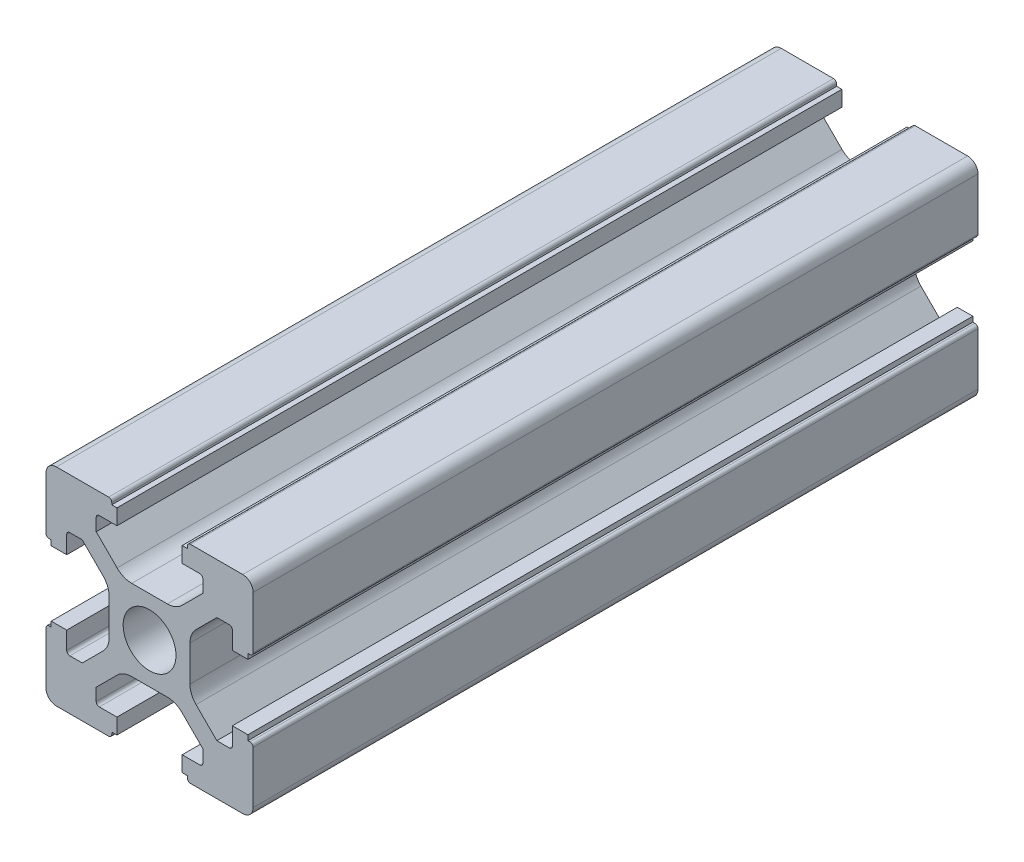
from build123d import *

# Parameters (mm, degrees)
SKETCH_1_RX     = 2.55
SKETCH_1_RY     = 2.55
EXTRUDE_1_DEPTH = 70


with BuildPart() as part:
    # 草图1 → 凸台-拉伸1 (new body)
    with BuildSketch(Plane.XY):
        with BuildLine():
            Line((-10, -9), (-10, -3.95))
            add(Edge.make_bspline(
                [(-9.7, -3.65), (-10, -3.65), (-10, -3.95)],
                knots=[4.71238898, 4.71238898, 4.71238898, 6.283185307, 6.283185307, 6.283185307], degree=2, weights=[1, 0.707106781, 1]))
            Line((-9.7, -3.65), (-9.5, -3.65))
            Line((-9.5, -3.65), (-9.5, -3.15))
            Line((-9.5, -3.15), (-8, -3.15))
            Line((-8, -3.15), (-8, -4.85))
            add(Edge.make_bspline(
                [(-8, -4.85), (-8, -5.15), (-7.7, -5.15)],
                knots=[3.141592654, 3.141592654, 3.141592654, 4.71238898, 4.71238898, 4.71238898], degree=2, weights=[1, 0.707106781, 1]))
            Line((-7.7, -5.15), (-6.5, -5.15))
            Line((-6.5, -5.15), (-4.485786438, -3.135786438))
            add(Edge.make_bspline(
                [(-4.485786438, -3.135786438), (-3.9, -2.55), (-3.9, -1.721572875)],
                knots=[0.785398163, 0.785398163, 0.785398163, 1.570796327, 1.570796327, 1.570796327], degree=2, weights=[1, 0.923879533, 1]))
            Line((-3.9, -1.721572875), (-3.9, 1.721572875))
            add(Edge.make_bspline(
                [(-3.9, 1.721572875), (-3.9, 2.55), (-4.485786438, 3.135786438)],
                knots=[0, 0, 0, 0.785398163, 0.785398163, 0.785398163], degree=2, weights=[1, 0.923879533, 1]))
            Line((-4.485786438, 3.135786438), (-6.5, 5.15))
            Line((-6.5, 5.15), (-7.7, 5.15))
            add(Edge.make_bspline(
                [(-7.7, 5.15), (-8, 5.15), (-8, 4.85)],
                knots=[1.570796327, 1.570796327, 1.570796327, 3.141592654, 3.141592654, 3.141592654], degree=2, weights=[1, 0.707106781, 1]))
            Line((-8, 4.85), (-8, 3.15))
            Line((-8, 3.15), (-9.5, 3.15))
            Line((-9.5, 3.15), (-9.5, 3.65))
            Line((-9.5, 3.65), (-9.7, 3.65))
            add(Edge.make_bspline(
                [(-10, 3.95), (-10, 3.65), (-9.7, 3.65)],
                knots=[3.141592654, 3.141592654, 3.141592654, 4.71238898, 4.71238898, 4.71238898], degree=2, weights=[1, 0.707106781, 1]))
            Line((-10, 3.95), (-10, 9))
            add(Edge.make_bspline(
                [(-9, 10), (-10, 10), (-10, 9)],
                knots=[4.71238898, 4.71238898, 4.71238898, 6.283185307, 6.283185307, 6.283185307], degree=2, weights=[1, 0.707106781, 1]))
            Line((-9, 10), (-3.95, 10))
            add(Edge.make_bspline(
                [(-3.65, 9.7), (-3.65, 10), (-3.95, 10)],
                knots=[0, 0, 0, 1.570796327, 1.570796327, 1.570796327], degree=2, weights=[1, 0.707106781, 1]))
            Line((-3.65, 9.7), (-3.65, 9.5))
            Line((-3.65, 9.5), (-3.15, 9.5))
            Line((-3.15, 9.5), (-3.15, 8))
            Line((-3.15, 8), (-4.85, 8))
            add(Edge.make_bspline(
                [(-4.85, 8), (-5.15, 8), (-5.15, 7.7)],
                knots=[1.570796327, 1.570796327, 1.570796327, 3.141592654, 3.141592654, 3.141592654], degree=2, weights=[1, 0.707106781, 1]))
            Line((-5.15, 7.7), (-5.15, 6.5))
            Line((-5.15, 6.5), (-3.135786438, 4.485786438))
            add(Edge.make_bspline(
                [(-3.135786438, 4.485786438), (-2.55, 3.9), (-1.721572875, 3.9)],
                knots=[3.926990817, 3.926990817, 3.926990817, 4.71238898, 4.71238898, 4.71238898], degree=2, weights=[1, 0.923879533, 1]))
            Line((-1.721572875, 3.9), (1.721572875, 3.9))
            add(Edge.make_bspline(
                [(1.721572875, 3.9), (2.55, 3.9), (3.135786438, 4.485786438)],
                knots=[1.570796327, 1.570796327, 1.570796327, 2.35619449, 2.35619449, 2.35619449], degree=2, weights=[1, 0.923879533, 1]))
            Line((3.135786438, 4.485786438), (5.15, 6.5))
            Line((5.15, 6.5), (5.15, 7.7))
            add(Edge.make_bspline(
                [(5.15, 7.7), (5.15, 8), (4.85, 8)],
                knots=[4.71238898, 4.71238898, 4.71238898, 6.283185307, 6.283185307, 6.283185307], degree=2, weights=[1, 0.707106781, 1]))
            Line((4.85, 8), (3.15, 8))
            Line((3.15, 8), (3.15, 9.5))
            Line((3.15, 9.5), (3.65, 9.5))
            Line((3.65, 9.5), (3.65, 9.7))
            add(Edge.make_bspline(
                [(3.95, 10), (3.65, 10), (3.65, 9.7)],
                knots=[0, 0, 0, 1.570796327, 1.570796327, 1.570796327], degree=2, weights=[1, 0.707106781, 1]))
            Line((3.95, 10), (9, 10))
            add(Edge.make_bspline(
                [(10, 9), (10, 10), (9, 10)],
                knots=[0, 0, 0, 1.570796327, 1.570796327, 1.570796327], degree=2, weights=[1, 0.707106781, 1]))
            Line((10, 9), (10, 3.95))
            add(Edge.make_bspline(
                [(9.7, 3.65), (10, 3.65), (10, 3.95)],
                knots=[4.71238898, 4.71238898, 4.71238898, 6.283185307, 6.283185307, 6.283185307], degree=2, weights=[1, 0.707106781, 1]))
            Line((9.7, 3.65), (9.5, 3.65))
            Line((9.5, 3.65), (9.5, 3.15))
            Line((9.5, 3.15), (8, 3.15))
            Line((8, 3.15), (8, 4.85))
            add(Edge.make_bspline(
                [(8, 4.85), (8, 5.15), (7.7, 5.15)],
                knots=[3.141592654, 3.141592654, 3.141592654, 4.71238898, 4.71238898, 4.71238898], degree=2, weights=[1, 0.707106781, 1]))
            Line((7.7, 5.15), (6.5, 5.15))
            Line((6.5, 5.15), (4.485786438, 3.135786438))
            add(Edge.make_bspline(
                [(4.485786438, 3.135786438), (3.9, 2.55), (3.9, 1.721572875)],
                knots=[2.35619449, 2.35619449, 2.35619449, 3.141592654, 3.141592654, 3.141592654], degree=2, weights=[1, 0.923879533, 1]))
            Line((3.9, 1.721572875), (3.9, -1.721572875))
            add(Edge.make_bspline(
                [(3.9, -1.721572875), (3.9, -2.55), (4.485786438, -3.135786438)],
                knots=[3.141592654, 3.141592654, 3.141592654, 3.926990817, 3.926990817, 3.926990817], degree=2, weights=[1, 0.923879533, 1]))
            Line((4.485786438, -3.135786438), (6.5, -5.15))
            Line((6.5, -5.15), (7.7, -5.15))
            add(Edge.make_bspline(
                [(7.7, -5.15), (8, -5.15), (8, -4.85)],
                knots=[4.71238898, 4.71238898, 4.71238898, 6.283185307, 6.283185307, 6.283185307], degree=2, weights=[1, 0.707106781, 1]))
            Line((8, -4.85), (8, -3.15))
            Line((8, -3.15), (9.5, -3.15))
            Line((9.5, -3.15), (9.5, -3.65))
            Line((9.5, -3.65), (9.7, -3.65))
            add(Edge.make_bspline(
                [(10, -3.95), (10, -3.65), (9.7, -3.65)],
                knots=[0, 0, 0, 1.570796327, 1.570796327, 1.570796327], degree=2, weights=[1, 0.707106781, 1]))
            Line((10, -3.95), (10, -9))
            add(Edge.make_bspline(
                [(9, -10), (10, -10), (10, -9)],
                knots=[4.71238898, 4.71238898, 4.71238898, 6.283185307, 6.283185307, 6.283185307], degree=2, weights=[1, 0.707106781, 1]))
            Line((9, -10), (3.95, -10))
            add(Edge.make_bspline(
                [(3.65, -9.7), (3.65, -10), (3.95, -10)],
                knots=[1.570796327, 1.570796327, 1.570796327, 3.141592654, 3.141592654, 3.141592654], degree=2, weights=[1, 0.707106781, 1]))
            Line((3.65, -9.7), (3.65, -9.5))
            Line((3.65, -9.5), (3.15, -9.5))
            Line((3.15, -9.5), (3.15, -8))
            Line((3.15, -8), (4.85, -8))
            add(Edge.make_bspline(
                [(4.85, -8), (5.15, -8), (5.15, -7.7)],
                knots=[3.141592654, 3.141592654, 3.141592654, 4.71238898, 4.71238898, 4.71238898], degree=2, weights=[1, 0.707106781, 1]))
            Line((5.15, -7.7), (5.15, -6.5))
            Line((5.15, -6.5), (3.135786438, -4.485786438))
            add(Edge.make_bspline(
                [(3.135786438, -4.485786438), (2.55, -3.9), (1.721572875, -3.9)],
                knots=[5.497787144, 5.497787144, 5.497787144, 6.283185307, 6.283185307, 6.283185307], degree=2, weights=[1, 0.923879533, 1]))
            Line((1.721572875, -3.9), (-1.721572875, -3.9))
            add(Edge.make_bspline(
                [(-1.721572875, -3.9), (-2.55, -3.9), (-3.135786438, -4.485786438)],
                knots=[0, 0, 0, 0.785398163, 0.785398163, 0.785398163], degree=2, weights=[1, 0.923879533, 1]))
            Line((-3.135786438, -4.485786438), (-5.15, -6.5))
            Line((-5.15, -6.5), (-5.15, -7.7))
            add(Edge.make_bspline(
                [(-5.15, -7.7), (-5.15, -8), (-4.85, -8)],
                knots=[3.141592654, 3.141592654, 3.141592654, 4.71238898, 4.71238898, 4.71238898], degree=2, weights=[1, 0.707106781, 1]))
            Line((-4.85, -8), (-3.15, -8))
            Line((-3.15, -8), (-3.15, -9.5))
            Line((-3.15, -9.5), (-3.65, -9.5))
            Line((-3.65, -9.5), (-3.65, -9.7))
            add(Edge.make_bspline(
                [(-3.95, -10), (-3.65, -10), (-3.65, -9.7)],
                knots=[4.71238898, 4.71238898, 4.71238898, 6.283185307, 6.283185307, 6.283185307], degree=2, weights=[1, 0.707106781, 1]))
            Line((-3.95, -10), (-9, -10))
            add(Edge.make_bspline(
                [(-10, -9), (-10, -10), (-9, -10)],
                knots=[0, 0, 0, 1.570796327, 1.570796327, 1.570796327], degree=2, weights=[1, 0.707106781, 1]))
        make_face()
        with Locations((0, 0)):
            Ellipse(SKETCH_1_RX, SKETCH_1_RY, mode=Mode.SUBTRACT)
    extrude(amount=EXTRUDE_1_DEPTH)


solid = part.part
